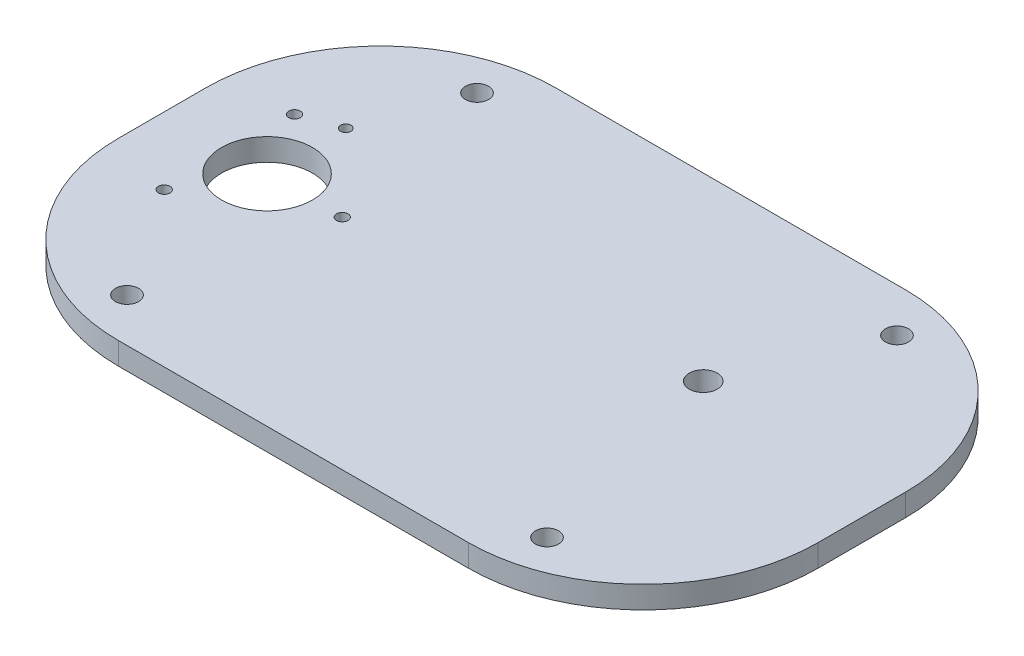
from build123d import *

# Parameters (mm, degrees)
SKETCH2_W                = 200
SKETCH2_H                = 125
SKETCH2_R                = 1.65
SKETCH2_R_2              = 13
SKETCH2_R_3              = 1.5
SKETCH2_R_4              = 4
BOSS_EXTRUDE1_DEPTH      = 6.35
FILLET1_R                = 50
M6_CLEARANCE_HOLE1_D     = 6.6
M6_CLEARANCE_HOLE1_DEPTH = 15
M6_CLEARANCE_HOLE1_TIP   = 1.982840043


with BuildPart() as part:
    # Sketch2 → Boss-Extrude1 (new body)
    with BuildSketch(Plane(origin=(0, 0, 0), x_dir=(1, 0, 0), z_dir=(0, 1, 0))):
        Rectangle(SKETCH2_W, SKETCH2_H)
        with Locations(Location((-48.5, 0, 0), (0, 0, 270))):
            Circle(SKETCH2_R, mode=Mode.SUBTRACT)
        with Locations(Location((-80.75, -18.619546181, 0), (0, 0, 270))):
            Circle(SKETCH2_R, mode=Mode.SUBTRACT)
        with Locations(Location((-70, 0, 0), (0, 0, 270))):
            Circle(SKETCH2_R_2, mode=Mode.SUBTRACT)
        with Locations(Location((-80.75, 18.619546181, 0), (0, 0, 270))):
            Circle(SKETCH2_R, mode=Mode.SUBTRACT)
        with Locations(Location((-70, 22.5, 0), (0, 0, 270))):
            Circle(SKETCH2_R_3, mode=Mode.SUBTRACT)
        with Locations(Location((43.64387632, 11, 0), (0, 0, 270))):
            Circle(SKETCH2_R_4, mode=Mode.SUBTRACT)
    extrude(amount=BOSS_EXTRUDE1_DEPTH)

    # Fillet1
    fillet1_edges = [part.edges().sort_by_distance(p)[0] for p in [
        (-100, 3.175, 62.5),
        (-100, 3.175, -62.5),
        (100, 3.175, -62.5),
        (100, 3.175, 62.5),
    ]]
    fillet(fillet1_edges, radius=FILLET1_R)

    # M6 Clearance Hole1
    with Locations(Plane(origin=(0, 6.35, 0), x_dir=(1, 0, 0), z_dir=(0, 1, 0))):
        with Locations((60, 50), (-60, -50), (-60, 50), (60, -50)):
            Hole(M6_CLEARANCE_HOLE1_D / 2, depth=M6_CLEARANCE_HOLE1_DEPTH)
            with Locations((0, 0, -(M6_CLEARANCE_HOLE1_DEPTH + M6_CLEARANCE_HOLE1_TIP / 2))):  # 118° drill point
                Cone(0, M6_CLEARANCE_HOLE1_D / 2, M6_CLEARANCE_HOLE1_TIP, mode=Mode.SUBTRACT)


solid = part.part
